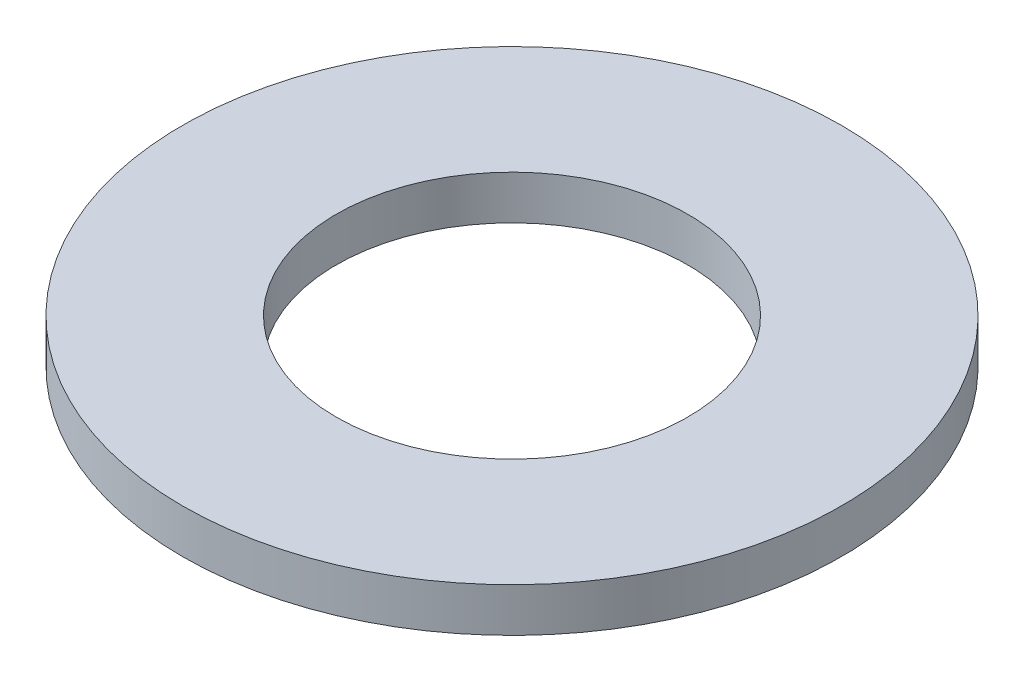
from build123d import *

# Parameters (mm, degrees)
SKETCH1_R           = 3
SKETCH1_R_2         = 1.6
BOSS_EXTRUDE1_DEPTH = 0.4


with BuildPart() as part:
    # Sketch1 → Boss-Extrude1 (new body)
    with BuildSketch(Plane(origin=(0, 0, 0), x_dir=(1, 0, 0), z_dir=(0, 1, 0))):
        with Locations(Location((0, 0, 0), (0, 0, 270))):
            Circle(SKETCH1_R)
        with Locations(Location((0, 0, 0), (0, 0, 270))):
            Circle(SKETCH1_R_2, mode=Mode.SUBTRACT)
    extrude(amount=BOSS_EXTRUDE1_DEPTH)


solid = part.part
